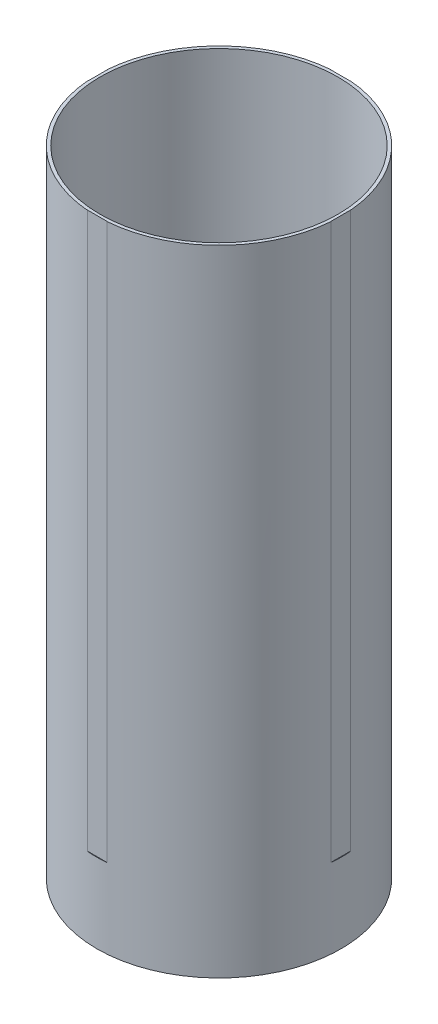
from build123d import *

# Parameters (mm, degrees)
SKETCH1_R           = 78.232
SKETCH1_R_2         = 76.2
BOSS_EXTRUDE1_DEPTH = 406.4
CUT_EXTRUDE1_DEPTH  = 0.381
CIRPATTERN1_COUNT   = 4


with BuildPart() as part:
    # Sketch1 → Boss-Extrude1 (new body)
    with BuildSketch(Plane(origin=(0, 0, 0), x_dir=(1, 0, 0), z_dir=(0, 1, 0))):
        with Locations(Location((0, 0, 0), (0, 0, 270))):
            Circle(SKETCH1_R)
        with Locations(Location((0, 0, 0), (0, 0, 270))):
            Circle(SKETCH1_R_2, mode=Mode.SUBTRACT)
    extrude(amount=BOSS_EXTRUDE1_DEPTH)

    # Sketch2 → Cut-Extrude1 (cut)
    with BuildSketch(Plane(origin=(78.232, 0, 0), x_dir=(0, 0, -1), z_dir=(1, 0, 0))):
        Polygon((0, 406.4), (6.35, 406.4), (6.35, 50.8), (-6.35, 50.8), (-6.35, 406.4), align=None)
    cut_extrude1 = extrude(amount=-CUT_EXTRUDE1_DEPTH, mode=Mode.SUBTRACT)

    # CirPattern1: Cut-Extrude1 ×4 about axis
    cirpattern1_axis = Axis((0, 0, 0), (0, 1, 0))
    for i in range(1, CIRPATTERN1_COUNT):
        add(cut_extrude1.rotate(cirpattern1_axis, i * 360 / CIRPATTERN1_COUNT), mode=Mode.SUBTRACT)


solid = part.part
